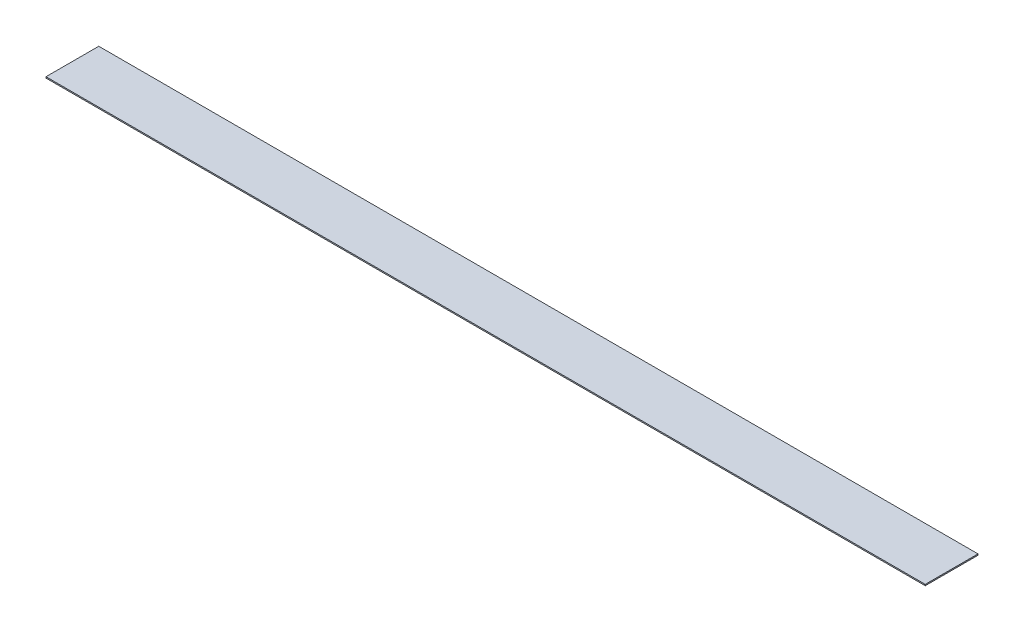
from build123d import *

# Parameters (mm, degrees)
SKETCH1_W           = 50
SKETCH1_H           = 3
BOSS_EXTRUDE1_DEPTH = 0.07


with BuildPart() as part:
    # Sketch1 → Boss-Extrude1 (new body)
    with BuildSketch(Plane(origin=(0, 0, 0), x_dir=(1, 0, 0), z_dir=(0, 1, 0))):
        Rectangle(SKETCH1_W, SKETCH1_H)
    extrude(amount=BOSS_EXTRUDE1_DEPTH)


solid = part.part
